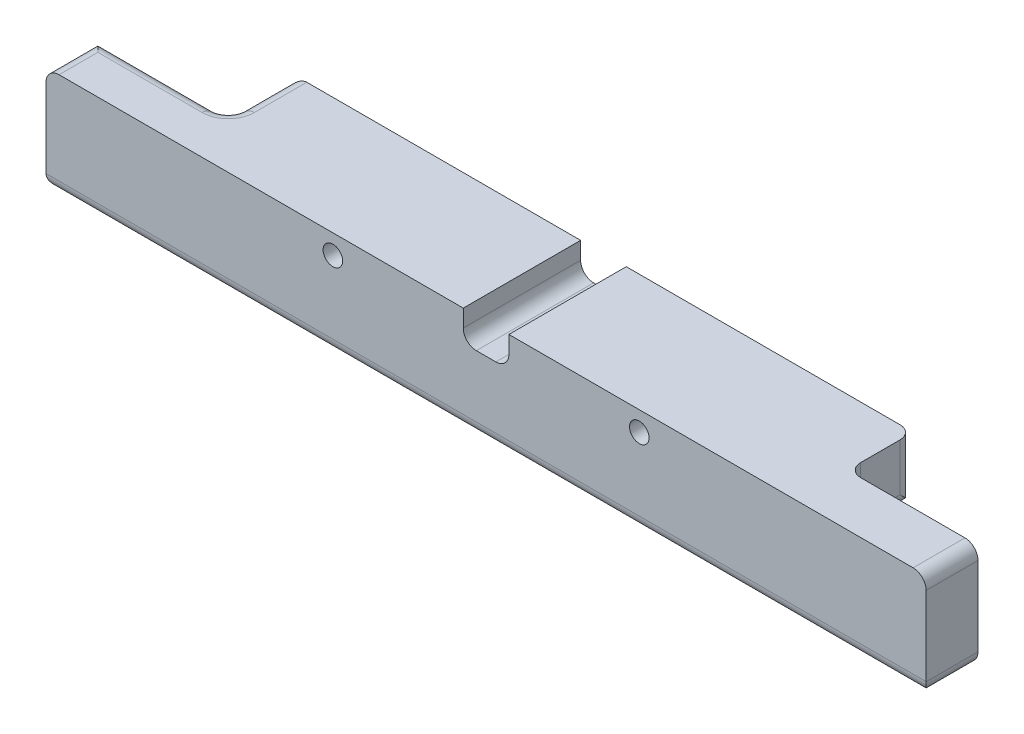
from build123d import *

# Parameters (mm, degrees)
BOSS_EXTRU_1_DEPTH      = 18
ESQUISSE2_R             = 1.5
ENL_V_MAT_EXTRU_1_DEPTH = 52.008553204
ESQUISSE3_W             = 7.950993182
ESQUISSE3_H             = 6.830138408
BOSS_EXTRU_2_DEPTH      = 95
ESQUISSE4_W             = 20
ESQUISSE4_H             = 16.130138408
BOSS_EXTRU_3_DEPTH      = 7.950993182
CONG_1_R                = 2


with BuildPart() as part:
    # Esquisse1 → Boss.-Extru.1 (new body)
    with BuildSketch(Plane.XY):
        Polygon((-47.5, 4.65), (-3.5, 4.65), (-3.5, 0), (3.5, 0), (3.5, 4.65), (47.5, 4.65), (47.5, -4.65), (-47.5, -4.65), align=None)
    extrude(amount=BOSS_EXTRU_1_DEPTH)

    # Esquisse2 → Enlèv. mat.-Extru.1 (cut, through all)
    with BuildSketch(Plane.XY.offset(18)):
        with Locations((-23.5, 1.65)):
            Circle(ESQUISSE2_R)
        with Locations(Location((23.5, 1.65, 0), (0, 0, 180))):
            Circle(ESQUISSE2_R)
    extrude(amount=-ENL_V_MAT_EXTRU_1_DEPTH, mode=Mode.SUBTRACT)

    # Esquisse3 → Boss.-Extru.2 (add)
    with BuildSketch(Plane.ZY.offset(47.5)):
        with Locations((14.024503409, -8.065069204)):
            Rectangle(ESQUISSE3_W, ESQUISSE3_H)
    extrude(amount=-BOSS_EXTRU_2_DEPTH)

    # Esquisse4 → Boss.-Extru.3 (add)
    with BuildSketch(Plane.XY.offset(18)):
        with Locations((-57.5, -3.415069204)):
            Rectangle(ESQUISSE4_W, ESQUISSE4_H)
        with Locations((57.5, -3.415069204)):
            Rectangle(ESQUISSE4_W, ESQUISSE4_H)
    extrude(amount=-BOSS_EXTRU_3_DEPTH)

    # Congé1
    cong_1_edges = [part.edges().sort_by_distance(p)[0] for p in [
        (-47.5, 4.65, 5.024503409),
        (0, -4.65, 10.049006818),
        (0, -11.480138408, 18),
        (-3.5, 0, 9),
        (3.5, 0, 9),
        (-57.5, 4.65, 10.049006818),
        (47.5, -4.65, 5.024503409),
        (47.5, 0, 0),
        (-47.5, 0, 0),
        (47.5, 0, 10.049006818),
        (-47.5, 0, 10.049006818),
        (67.5, 4.65, 14.024503409),
        (67.5, -11.480138408, 14.024503409),
        (-67.5, 4.65, 14.024503409),
        (-67.5, -11.480138408, 14.024503409),
    ]]
    fillet(cong_1_edges, radius=CONG_1_R)


solid = part.part
